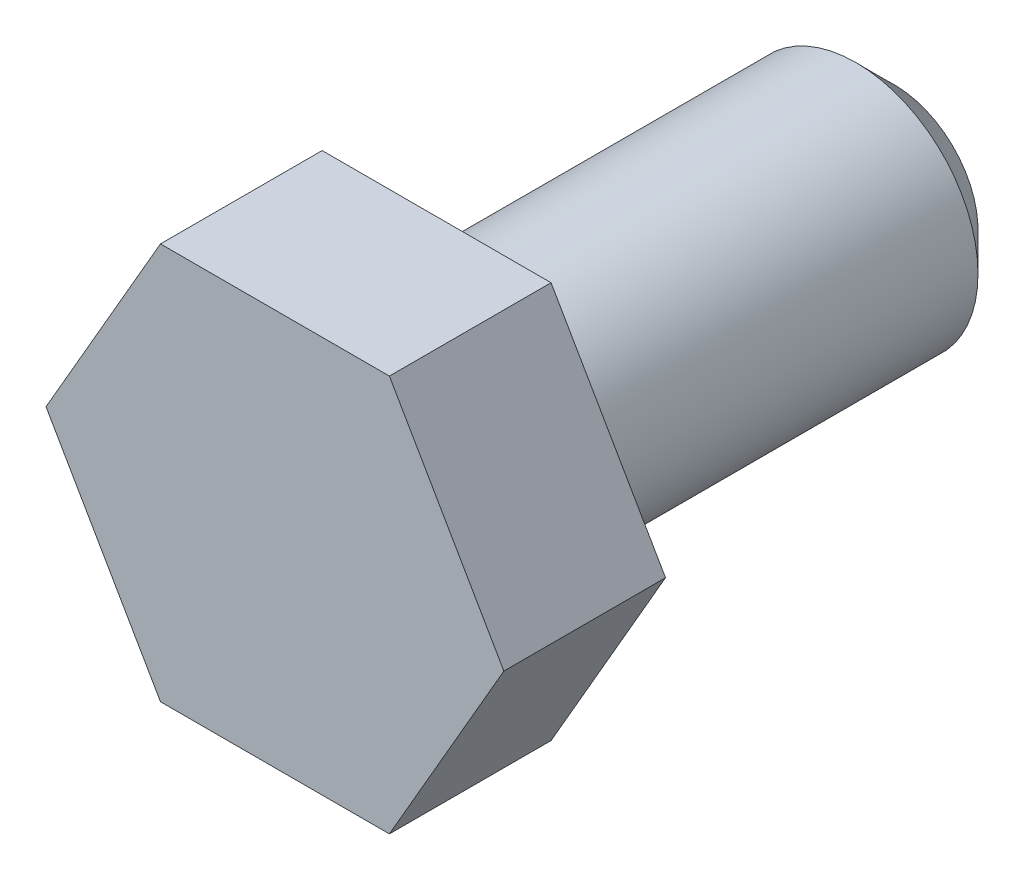
from build123d import *

# Parameters (mm, degrees)
BASE_EXTRUDE_DEPTH  = 5.3
SKETCH3_R           = 4
BOSS_EXTRUDE1_DEPTH = 15
CHAMFER1_SIZE       = 1.25


with BuildPart() as part:
    # Sketch1 → Base-Extrude (new body)
    with BuildSketch(Plane.XY):
        Polygon((-3.75277675, 6.5), (3.75277675, 6.5), (7.505553499, 0), (3.75277675, -6.5), (-3.75277675, -6.5), (-7.505553499, 0), align=None)
    extrude(amount=BASE_EXTRUDE_DEPTH)

    # Sketch3 → Boss-Extrude1 (add)
    with BuildSketch(Plane(origin=(0, 0, 0), x_dir=(-1, 0, 0), z_dir=(0, 0, -1))):
        with Locations(Location((0, 0, 0), (0, 0, 180))):
            Circle(SKETCH3_R)
    extrude(amount=BOSS_EXTRUDE1_DEPTH)

    # Chamfer1
    chamfer1_edges = [part.edges().sort_by_distance(p)[0] for p in [
        (-4, 0, -15),
    ]]
    chamfer(chamfer1_edges, length=CHAMFER1_SIZE)


solid = part.part
